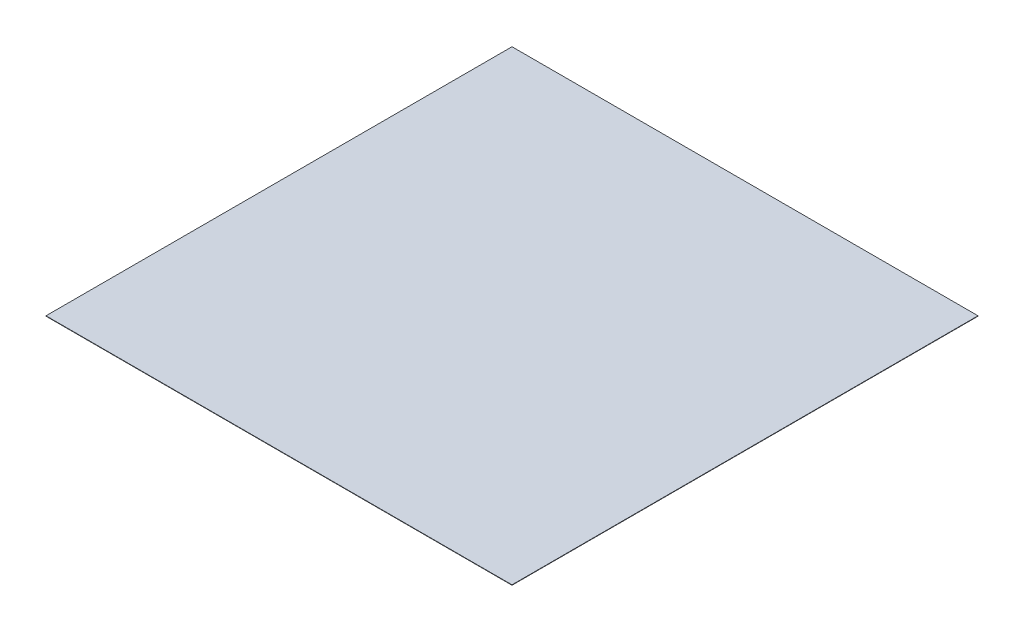
from build123d import *

# Parameters (mm, degrees)
BOSS_EXTRUDE1_DEPTH = 20
BOSS_EXTRUDE2_START = -5
SKETCH3_W           = 26.197224363
SKETCH3_H           = 40
SKETCH3_R           = 1.5
SKETCH3_W_2         = 30.197224362
BOSS_EXTRUDE2_DEPTH = 5
SKETCH4_W           = 1200
SKETCH4_H           = 1200
BOSS_EXTRUDE3_DEPTH = 1
SKETCH5_R           = 1.5
BOSS_EXTRUDE4_DEPTH = 13.5


with BuildPart() as part:
    # Sketch2 → Boss-Extrude1 (new body)
    with BuildSketch(Plane(origin=(0, 0, 134.88320255), x_dir=(-1, 0, 0), z_dir=(0, 0, -1))):
        with BuildLine():
            Line((-8.010113394, 153.56443927), (-27.207337757, 153.56443927))
            ThreePointArc((-27.207337757, 153.56443927), (-25.963827563, 152.287849446), (-25.510113394, 150.56443927))
            Line((-25.510113394, 150.56443927), (-25.510113394, 146.56443927))
            ThreePointArc((-25.510113394, 146.56443927), (-24.777880347, 144.796672317), (-23.010113394, 144.06443927))
            Line((-23.010113394, 144.06443927), (-19.010113394, 144.06443927))
            ThreePointArc((-19.010113394, 144.06443927), (-16.53523966, 143.039313005), (-15.510113394, 140.56443927))
            Line((-15.510113394, 140.56443927), (-15.510113394, 106.56443927))
            ThreePointArc((-15.510113394, 106.56443927), (-16.53523966, 104.089565536), (-19.010113394, 103.06443927))
            Line((-19.010113394, 103.06443927), (-23.010113394, 103.06443927))
            ThreePointArc((-23.010113394, 103.06443927), (-24.777880347, 102.332206223), (-25.510113394, 100.56443927))
            Line((-25.510113394, 100.56443927), (-25.510113394, 96.56443927))
            ThreePointArc((-25.510113394, 96.56443927), (-26.53523966, 94.089565536), (-29.010113394, 93.06443927))
            Line((-29.010113394, 93.06443927), (-63.010113394, 93.06443927))
            ThreePointArc((-63.010113394, 93.06443927), (-65.484987129, 94.089565536), (-66.510113394, 96.56443927))
            Line((-66.510113394, 96.56443927), (-66.510113394, 100.56443927))
            ThreePointArc((-66.510113394, 100.56443927), (-67.242346441, 102.332206223), (-69.010113394, 103.06443927))
            Line((-69.010113394, 103.06443927), (-73.010113394, 103.06443927))
            ThreePointArc((-73.010113394, 103.06443927), (-75.484987129, 104.089565536), (-76.510113394, 106.56443927))
            Line((-76.510113394, 106.56443927), (-76.510113394, 140.56443927))
            ThreePointArc((-76.510113394, 140.56443927), (-75.484987129, 143.039313005), (-73.010113394, 144.06443927))
            Line((-73.010113394, 144.06443927), (-69.010113394, 144.06443927))
            ThreePointArc((-69.010113394, 144.06443927), (-67.242346441, 144.796672317), (-66.510113394, 146.56443927))
            Line((-66.510113394, 146.56443927), (-66.510113394, 150.56443927))
            ThreePointArc((-66.510113394, 150.56443927), (-66.056399226, 152.287849446), (-64.812889032, 153.56443927))
            Line((-64.812889032, 153.56443927), (-84.010113394, 153.56443927))
            Line((-84.010113394, 153.56443927), (-84.010113394, 140.56443927))
            Line((-84.010113394, 140.56443927), (-84.010113394, 106.56443927))
            ThreePointArc((-84.010113394, 106.56443927), (-81.119985899, 99.13275252), (-73.968301038, 95.606251627))
            ThreePointArc((-73.968301038, 95.606251627), (-70.441800145, 88.454566766), (-63.010113394, 85.56443927))
            Line((-63.010113394, 85.56443927), (-29.010113394, 85.56443927))
            ThreePointArc((-29.010113394, 85.56443927), (-21.578426644, 88.454566766), (-18.051925751, 95.606251627))
            ThreePointArc((-18.051925751, 95.606251627), (-10.90024089, 99.13275252), (-8.010113394, 106.56443927))
            Line((-8.010113394, 106.56443927), (-8.010113394, 140.56443927))
            Line((-8.010113394, 140.56443927), (-8.010113394, 153.56443927))
        make_face()
    extrude(amount=BOSS_EXTRUDE1_DEPTH)

    # Sketch3 → Boss-Extrude2 (add)
    # profile 1 of 2: a face of its own
    with BuildSketch(Plane(origin=(0, 153.56443927, 0), x_dir=(1, 0, 0), z_dir=(0, 1, 0)).offset(BOSS_EXTRUDE2_START)):
        with Locations((11.108725576, -124.88320255)):
            Rectangle(SKETCH3_W, SKETCH3_H)
        with Locations(Location((3.010113394, -139.88320255, 0), (0, 0, 270))):
            Circle(SKETCH3_R, mode=Mode.SUBTRACT)
        with Locations(Location((3.010113394, -109.88320255, 0), (0, 0, 90))):
            Circle(SKETCH3_R, mode=Mode.SUBTRACT)
    # profile 2 of 2: a face of its own
    with BuildSketch(Plane(origin=(0, 153.56443927, 0), x_dir=(1, 0, 0), z_dir=(0, 1, 0)).offset(BOSS_EXTRUDE2_START)):
        with Locations((82.911501213, -124.88320255)):
            Rectangle(SKETCH3_W_2, SKETCH3_H)
        with Locations(Location((93.010113394, -109.88320255, 0), (0, 0, 270))):
            Circle(SKETCH3_R, mode=Mode.SUBTRACT)
        with Locations(Location((93.010113394, -139.88320255, 0), (0, 0, 90))):
            Circle(SKETCH3_R, mode=Mode.SUBTRACT)
    extrude(amount=BOSS_EXTRUDE2_DEPTH)

    # Sketch5 → Boss-Extrude4 (add)
    with BuildSketch(Plane(origin=(0, 153.56443927, 0), x_dir=(1, 0, 0), z_dir=(0, 1, 0))):
        Polygon((98.010113394, -144.88320255), (98.010113394, -104.88320255), (67.812889032, -104.88320255), (24.207337757, -104.88320255), (-1.989886606, -104.88320255), (-1.989886606, -144.88320255), (24.207337757, -144.88320255), (67.812889032, -144.88320255), align=None)
        with Locations(Location((93.010113394, -139.88320255, 0), (0, 0, 90))):
            Circle(SKETCH5_R, mode=Mode.SUBTRACT)
        with Locations(Location((93.010113394, -109.88320255, 0), (0, 0, 180))):
            Circle(SKETCH5_R, mode=Mode.SUBTRACT)
        with Locations(Location((3.010113394, -139.88320255, 0), (0, 0, 180))):
            Circle(SKETCH5_R, mode=Mode.SUBTRACT)
        with Locations(Location((3.010113394, -109.88320255, 0), (0, 0, 90))):
            Circle(SKETCH5_R, mode=Mode.SUBTRACT)
    extrude(amount=BOSS_EXTRUDE4_DEPTH)


with BuildPart() as body_2:
    # Sketch4 → Boss-Extrude3 (new body)
    with BuildSketch(Plane(origin=(0, 223.56443927, 0), x_dir=(1, 0, 0), z_dir=(0, 1, 0))):
        Rectangle(SKETCH4_W, SKETCH4_H)
    extrude(amount=BOSS_EXTRUDE3_DEPTH)


solid = Compound([part.part, body_2.part])
